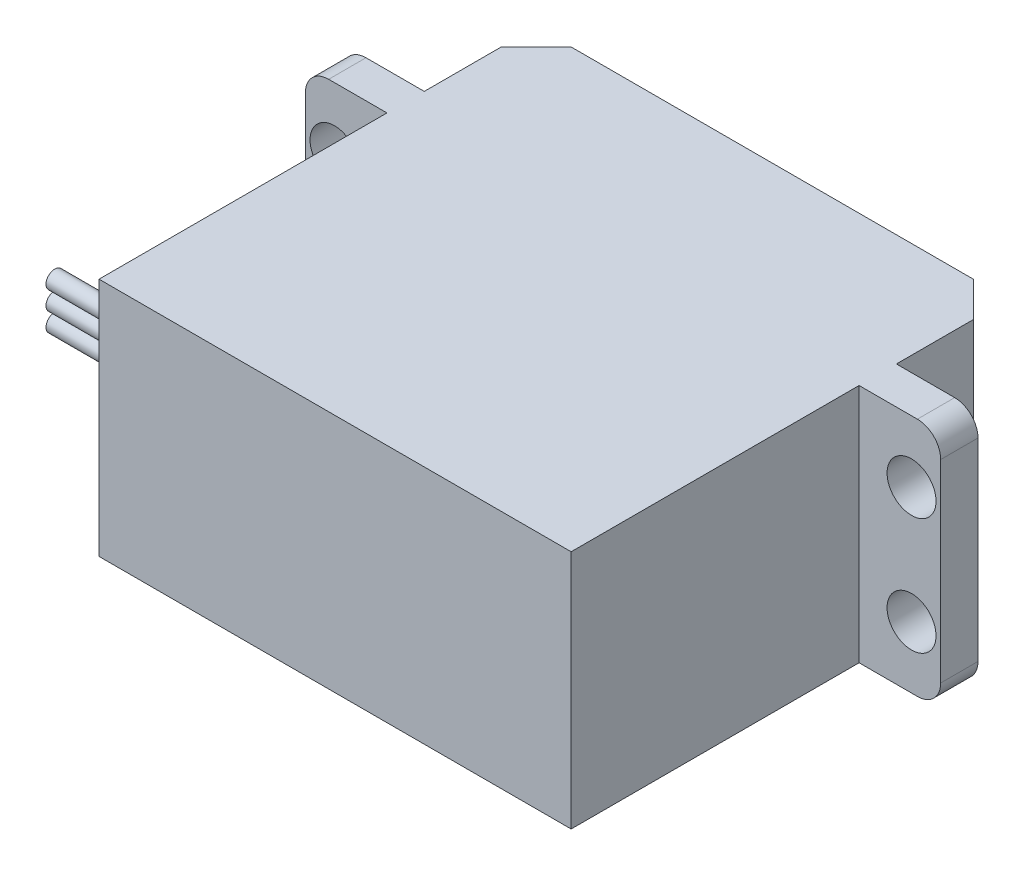
from build123d import *

# Parameters (mm, degrees)
BOSS_EXTRU_1_DEPTH                = 10.3
ESQUISSE3_W                       = 7
ESQUISSE3_H                       = 20.6
ESQUISSE3_R                       = 2.1
BOSS_EXTRU_2_DEPTH                = 3.2
BOSS_EXTRU_3_DEPTH                = 0.85
ESQUISSE8_R                       = 6.75
BOSS_EXTRU_7_DEPTH                = 1
ESQUISSE5_R                       = 2.925
BOSS_EXTRU_4_DEPTH                = 4.3
CONG_1_R                          = 2
ESQUISSE6_W                       = 3
ESQUISSE6_H                       = 6.8
BOSS_EXTRU_5_DEPTH                = 5.3
ESQUISSE7_R                       = 0.75
BOSS_EXTRU_6_DEPTH                = 5.3
DIAM_TRE_DU_PER_AGE_3_0_3_1_D     = 3
DIAM_TRE_DU_PER_AGE_3_0_3_1_DEPTH = 6
DIAM_TRE_DU_PER_AGE_3_0_3_1_TIP   = 0.901290929


with BuildPart() as part:
    # Esquisse1 → Boss.-Extru.1 (new, symmetric)
    with BuildSketch(Plane(origin=(0, 0, 0), x_dir=(1, 0, 0), z_dir=(0, 1, 0))):
        Polygon((-17.25, 9.3), (17.25, 9.3), (20.25, 6.3), (20.25, -28.2), (-20.25, -28.2), (-20.25, 6.3), align=None)
    extrude(amount=BOSS_EXTRU_1_DEPTH, both=True)

    # Esquisse3 → Boss.-Extru.2 (add)
    # profile 1 of 2: a face of its own
    with BuildSketch(Plane.XY.offset(3.5)):
        with Locations((23.75, 0)):
            Rectangle(ESQUISSE3_W, ESQUISSE3_H)
        with Locations((24.75, 5)):
            Circle(ESQUISSE3_R, mode=Mode.SUBTRACT)
        with Locations(Location((24.75, -5, 0), (0, 0, 180))):
            Circle(ESQUISSE3_R, mode=Mode.SUBTRACT)
    # profile 2 of 2: a face of its own
    with BuildSketch(Plane.XY.offset(3.5)):
        with Locations((-23.75, 0)):
            Rectangle(ESQUISSE3_W, ESQUISSE3_H)
        with Locations(Location((-24.75, 5, 0), (0, 0, 180))):
            Circle(ESQUISSE3_R, mode=Mode.SUBTRACT)
        with Locations((-24.75, -5)):
            Circle(ESQUISSE3_R, mode=Mode.SUBTRACT)
    extrude(amount=-BOSS_EXTRU_2_DEPTH)

    # Esquisse4 → Boss.-Extru.3 (add, symmetric)
    with BuildSketch(Plane(origin=(0, 0, 0), x_dir=(1, 0, 0), z_dir=(0, 1, 0))):
        Polygon((20.25, -0.3), (20.25, 1.6), (21.65, 1.6), (25.9, 0.2), (25.9, -0.3), align=None)
        Polygon((-25.9, -0.3), (-20.25, -0.3), (-20.25, 1.6), (-21.65, 1.6), (-25.9, 0.2), align=None)
    extrude(amount=BOSS_EXTRU_3_DEPTH, both=True)

    # Esquisse8 → Boss.-Extru.7 (add)
    with BuildSketch(Plane(origin=(0, 0, -9.3), x_dir=(-1, 0, 0), z_dir=(0, 0, -1))):
        with Locations(Location((10, 0, 0), (0, 0, 180))):
            Circle(ESQUISSE8_R)
    extrude(amount=BOSS_EXTRU_7_DEPTH)

    # Esquisse5 → Boss.-Extru.4 (add)
    with BuildSketch(Plane(origin=(0, 0, -10.3), x_dir=(-1, 0, 0), z_dir=(0, 0, -1))):
        with Locations(Location((10, 0, 0), (0, 0, 180))):
            Circle(ESQUISSE5_R)
    extrude(amount=BOSS_EXTRU_4_DEPTH)

    # Congé1
    cong_1_edges = [part.edges().sort_by_distance(p)[0] for p in [
        (27.25, 10.3, 1.9),
        (27.25, -10.3, 1.9),
        (-27.25, -10.3, 1.9),
        (-27.25, 10.3, 1.9),
    ]]
    fillet(cong_1_edges, radius=CONG_1_R)

    # Esquisse6 → Boss.-Extru.5 (add)
    with BuildSketch(Plane.ZY.offset(20.25)):
        with Locations((21.4, 0)):
            Rectangle(ESQUISSE6_W, ESQUISSE6_H)
    extrude(amount=BOSS_EXTRU_5_DEPTH)

    # Esquisse7 → Boss.-Extru.6 (add)
    with BuildSketch(Plane.ZY.offset(25.55)):
        with Locations((21.4, 0)):
            Circle(ESQUISSE7_R)
        with Locations((21.4, 1.6)):
            Circle(ESQUISSE7_R)
        with Locations(Location((21.4, -1.6, 0), (0, 0, 180))):
            Circle(ESQUISSE7_R)
    extrude(amount=BOSS_EXTRU_6_DEPTH)

    # Diamètre du perçage Ø3.0 (3)1
    with Locations(Plane(origin=(0, 0, -14.6), x_dir=(-1, 0, 0), z_dir=(0, 0, -1))):
        with Locations((10, 0)):
            Hole(DIAM_TRE_DU_PER_AGE_3_0_3_1_D / 2, depth=DIAM_TRE_DU_PER_AGE_3_0_3_1_DEPTH)
            with Locations((0, 0, -(DIAM_TRE_DU_PER_AGE_3_0_3_1_DEPTH + DIAM_TRE_DU_PER_AGE_3_0_3_1_TIP / 2))):  # 118° drill point
                Cone(0, DIAM_TRE_DU_PER_AGE_3_0_3_1_D / 2, DIAM_TRE_DU_PER_AGE_3_0_3_1_TIP, mode=Mode.SUBTRACT)


solid = part.part
